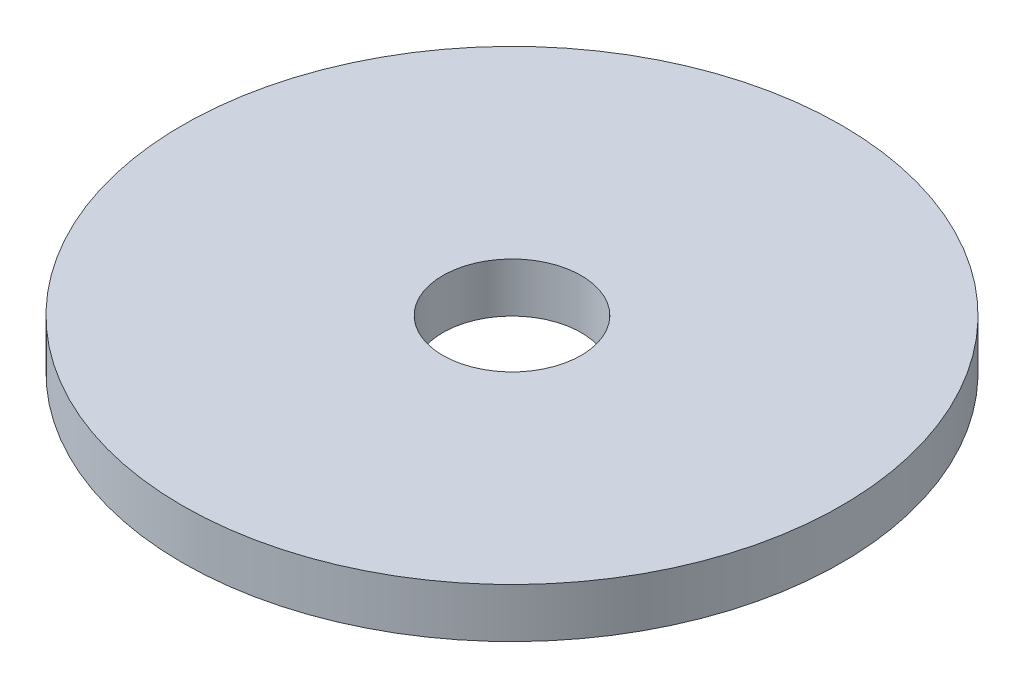
from build123d import *

# Parameters (mm, degrees)
SKETCH1_R           = 10
SKETCH1_R_2         = 2.1
BOSS_EXTRUDE1_DEPTH = 1.5


with BuildPart() as part:
    # Sketch1 → Boss-Extrude1 (new body)
    with BuildSketch(Plane(origin=(0, 0, 0), x_dir=(1, 0, 0), z_dir=(0, 1, 0))):
        with Locations(Location((0, 0, 0), (0, 0, 270))):
            Circle(SKETCH1_R)
        with Locations(Location((0, 0, 0), (0, 0, 270))):
            Circle(SKETCH1_R_2, mode=Mode.SUBTRACT)
    extrude(amount=BOSS_EXTRUDE1_DEPTH)


solid = part.part
